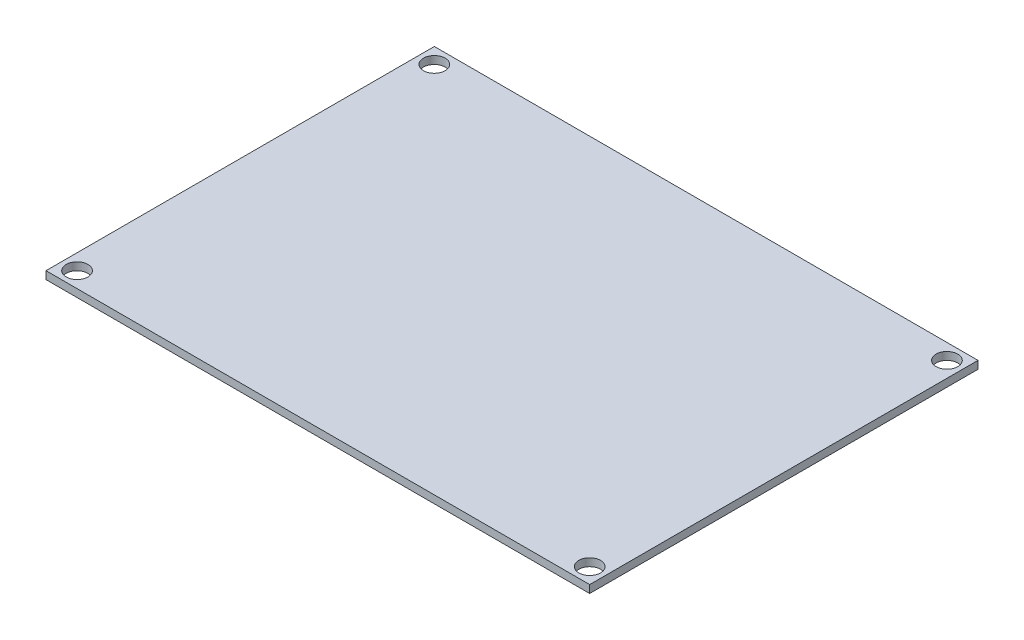
from build123d import *

# Parameters (mm, degrees)
SKETCH1_W           = 70
SKETCH1_H           = 50
BOSS_EXTRUDE1_DEPTH = 1
SKETCH2_R           = 1.4
CUT_EXTRUDE1_DEPTH  = 87.029064856


with BuildPart() as part:
    # Sketch1 → Boss-Extrude1 (new body)
    with BuildSketch(Plane(origin=(0, 0, 0), x_dir=(1, 0, 0), z_dir=(0, 1, 0))):
        with Locations((35, 25)):
            Rectangle(SKETCH1_W, SKETCH1_H)
    extrude(amount=BOSS_EXTRUDE1_DEPTH)

    # Sketch2 → Cut-Extrude1 (cut, through all)
    with BuildSketch(Plane(origin=(0, 1, 0), x_dir=(1, 0, 0), z_dir=(0, 1, 0))):
        with Locations(Location((2, 48, 0), (0, 0, 270))):
            Circle(SKETCH2_R)
        with Locations(Location((68, 48, 0), (0, 0, 270))):
            Circle(SKETCH2_R)
        with Locations(Location((68, 2, 0), (0, 0, 270))):
            Circle(SKETCH2_R)
        with Locations(Location((2, 2, 0), (0, 0, 270))):
            Circle(SKETCH2_R)
    extrude(amount=-CUT_EXTRUDE1_DEPTH, mode=Mode.SUBTRACT)


solid = part.part
